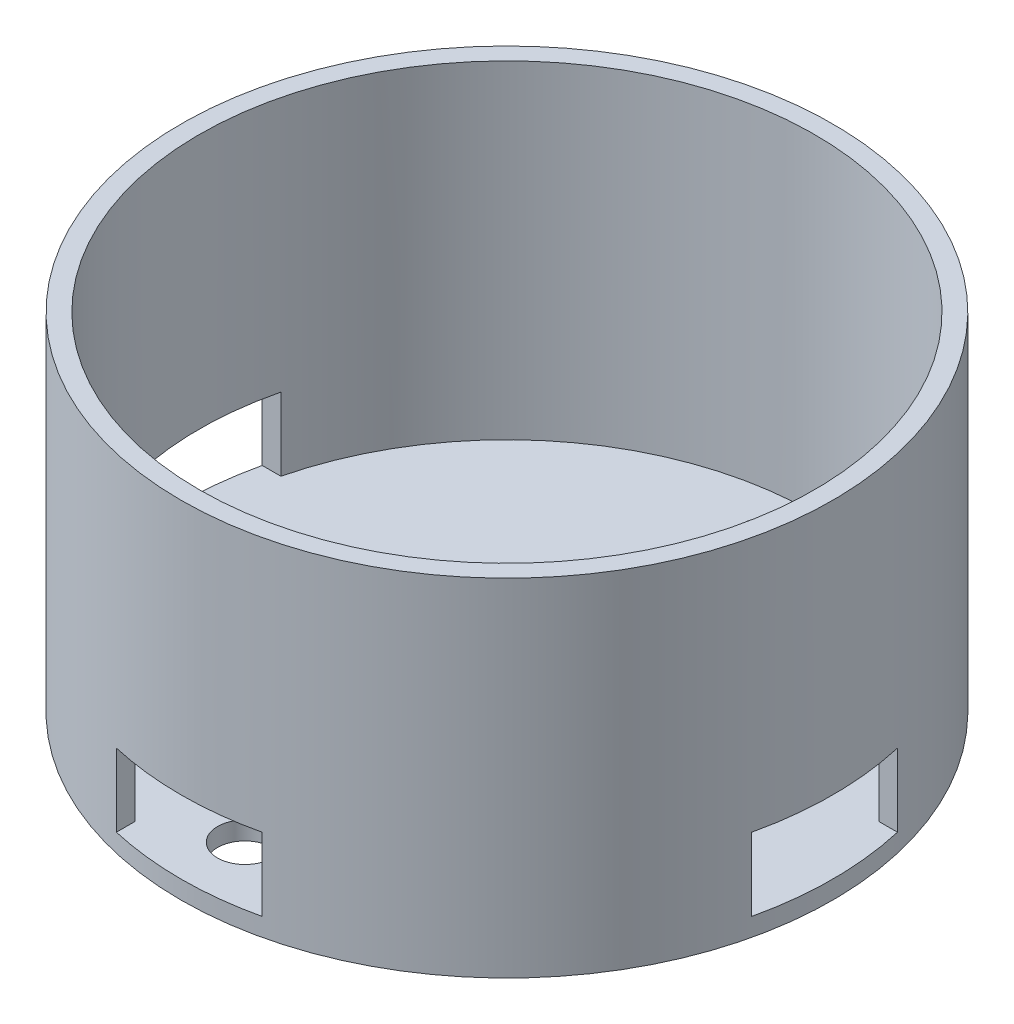
from build123d import *

# Parameters (mm, degrees)
SKETCH1_R           = 56.769
BOSS_EXTRUDE1_DEPTH = 3.175
SKETCH2_R           = 56.769
SKETCH2_R_2         = 53.594
BOSS_EXTRUDE2_DEPTH = 57.15
SKETCH3_W           = 25.4
SKETCH3_H           = 12.7
CUT_EXTRUDE1_DEPTH  = 101.421832024
CIRPATTERN1_COUNT   = 3
CIRPATTERN1_ANGLE   = 180
SKETCH4_R           = 4.7625
CUT_EXTRUDE2_DEPTH  = 99.547253752


with BuildPart() as part:
    # Sketch1 → Boss-Extrude1 (new body)
    with BuildSketch(Plane(origin=(0, 0, 0), x_dir=(1, 0, 0), z_dir=(0, 1, 0))):
        with Locations(Location((0, 0, 0), (0, 0, 270))):
            Circle(SKETCH1_R)
    extrude(amount=BOSS_EXTRUDE1_DEPTH)

    # Sketch2 → Boss-Extrude2 (add)
    with BuildSketch(Plane(origin=(0, 3.175, 0), x_dir=(1, 0, 0), z_dir=(0, 1, 0))):
        with Locations(Location((0, 0, 0), (0, 0, 270))):
            Circle(SKETCH2_R)
        with Locations(Location((0, 0, 0), (0, 0, 270))):
            Circle(SKETCH2_R_2, mode=Mode.SUBTRACT)
    extrude(amount=BOSS_EXTRUDE2_DEPTH)

    # Sketch3 → Cut-Extrude1 (cut, through all)
    with BuildSketch(Plane(origin=(0, 0, 0), x_dir=(0, 0, -1), z_dir=(1, 0, 0))):
        with Locations((0, 9.525)):
            Rectangle(SKETCH3_W, SKETCH3_H)
    cut_extrude1 = extrude(amount=-CUT_EXTRUDE1_DEPTH, mode=Mode.SUBTRACT)

    # CirPattern1: Cut-Extrude1 ×3 about axis
    cirpattern1_axis = Axis((0, 0, 0), (0, 1, 0))
    for i in range(1, CIRPATTERN1_COUNT):
        add(cut_extrude1.rotate(cirpattern1_axis, i * CIRPATTERN1_ANGLE / (CIRPATTERN1_COUNT - 1)), mode=Mode.SUBTRACT)

    # Sketch4 → Cut-Extrude2 (cut, through all)
    with BuildSketch(Plane(origin=(0, 3.175, 0), x_dir=(1, 0, 0), z_dir=(0, 1, 0))):
        with Locations(Location((0, 45.640625, 0), (0, 0, 270))):
            Circle(SKETCH4_R)
        with Locations(Location((0, 27.384375, 0), (0, 0, 270))):
            Circle(SKETCH4_R)
        with Locations(Location((0, 9.128125, 0), (0, 0, 270))):
            Circle(SKETCH4_R)
        with Locations(Location((0, -9.128125, 0), (0, 0, 270))):
            Circle(SKETCH4_R)
        with Locations(Location((0, -27.384375, 0), (0, 0, 270))):
            Circle(SKETCH4_R)
        with Locations(Location((0, -45.640625, 0), (0, 0, 270))):
            Circle(SKETCH4_R)
    extrude(amount=-CUT_EXTRUDE2_DEPTH, mode=Mode.SUBTRACT)


solid = part.part
